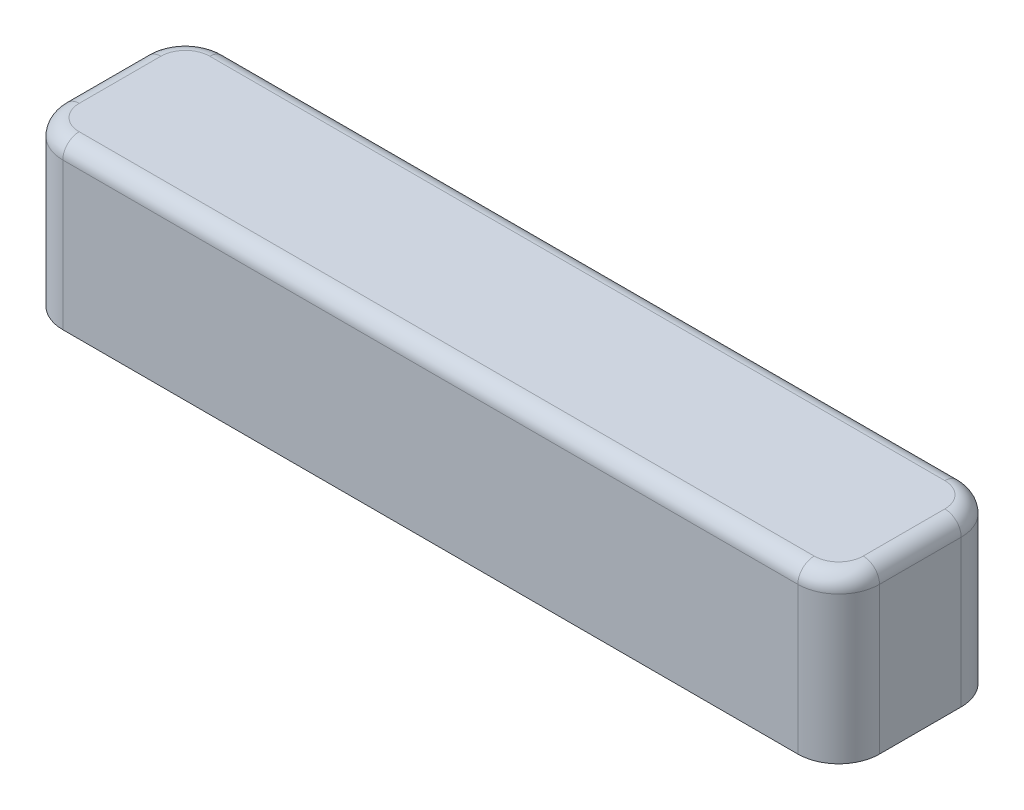
from build123d import *
from OCP.BRepFilletAPI import BRepFilletAPI_MakeFillet

# Parameters (mm, degrees)
SKETCH1_W           = 10
SKETCH1_H           = 2
BOSS_EXTRUDE1_DEPTH = 2
FILLET1_R1          = 0.2
FILLET1_R2          = 0.5


with BuildPart() as part:
    # Sketch1 → Boss-Extrude1 (new body)
    with BuildSketch(Plane(origin=(0, 0, 0), x_dir=(1, 0, 0), z_dir=(0, 1, 0))):
        with Locations((5, 1)):
            Rectangle(SKETCH1_W, SKETCH1_H)
    extrude(amount=BOSS_EXTRUDE1_DEPTH)

    # Fillet1: one fillet with a radius per group of edges: ONE call of the kernel's fillet builder (fillet() takes one radius for all edges)
    fillet1_edges_1 = [part.edges().sort_by_distance(p)[0] for p in [
        (10, 2, -1),
        (5, 2, -2),
        (0, 2, -1),
        (5, 2, 0),
    ]]
    fillet1_edges_2 = [part.edges().sort_by_distance(p)[0] for p in [
        (0, 1, -2),
        (10, 1, -2),
        (10, 1, 0),
        (0, 1, 0),
    ]]
    fillet1 = BRepFilletAPI_MakeFillet(part.part.solid().wrapped)
    for e in fillet1_edges_1:
        fillet1.Add(FILLET1_R1, e.wrapped)
    for e in fillet1_edges_2:
        fillet1.Add(FILLET1_R2, e.wrapped)
    add(Compound.cast(fillet1.Shape()), mode=Mode.REPLACE)


solid = part.part
